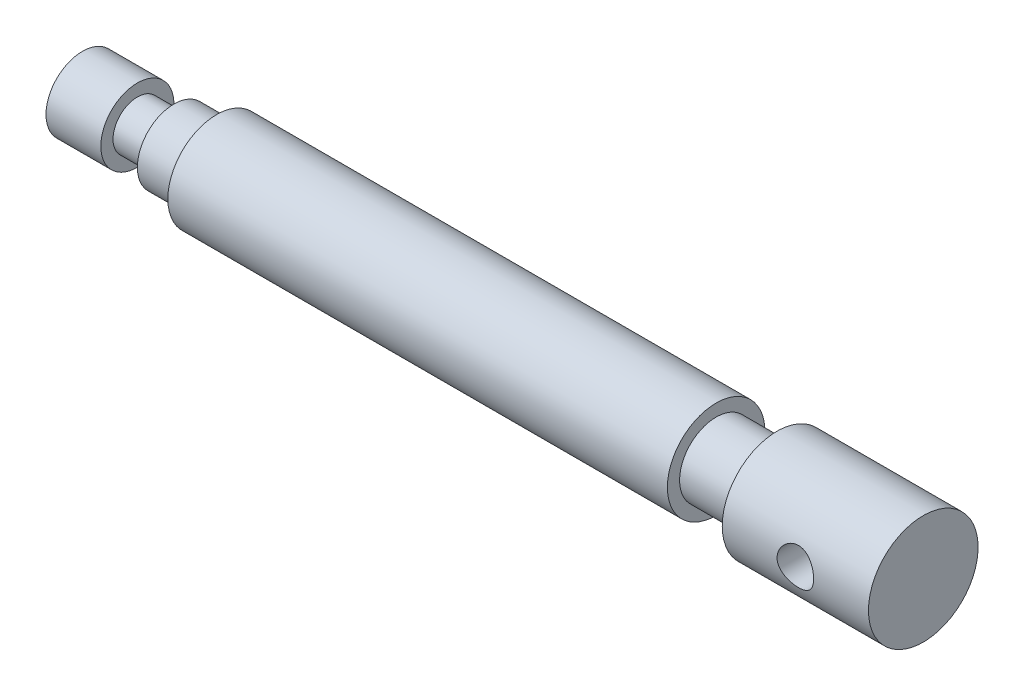
from build123d import *

# Parameters (mm, degrees)
CUT_EXTRUDE1_DEPTH      = 71.164093381
CUT_EXTRUDE1_DEPTH_BACK = 71.164093381
SKETCH2_R               = 3


with BuildPart() as part:
    # Sketch1 → Revolve1 (revolve)
    with BuildSketch(Plane.XY, mode=Mode.PRIVATE) as revolve1_sk:
        Polygon((69, 0), (69, 9), (45, 9), (45, 6), (35, 6), (35, 8), (-47, 8), (-47, 6), (-54, 6), (-54, 4), (-60, 4), (-60, 6), (-69, 6), (-69, 0), align=None)
    revolve(revolve1_sk.sketch.rotate(Axis((-69, 0, 0), (1, 0, 0)), 90), axis=Axis((-69, 0, 0), (1, 0, 0)))

    # Sketch2 → Cut-Extrude1 (cut, two sides: drawn at the far end of the back side and taken through both)
    with BuildSketch(Plane.XY.offset(-CUT_EXTRUDE1_DEPTH_BACK)):
        with Locations((57, 0)):
            Circle(SKETCH2_R)
    extrude(amount=CUT_EXTRUDE1_DEPTH + CUT_EXTRUDE1_DEPTH_BACK, mode=Mode.SUBTRACT)


solid = part.part
